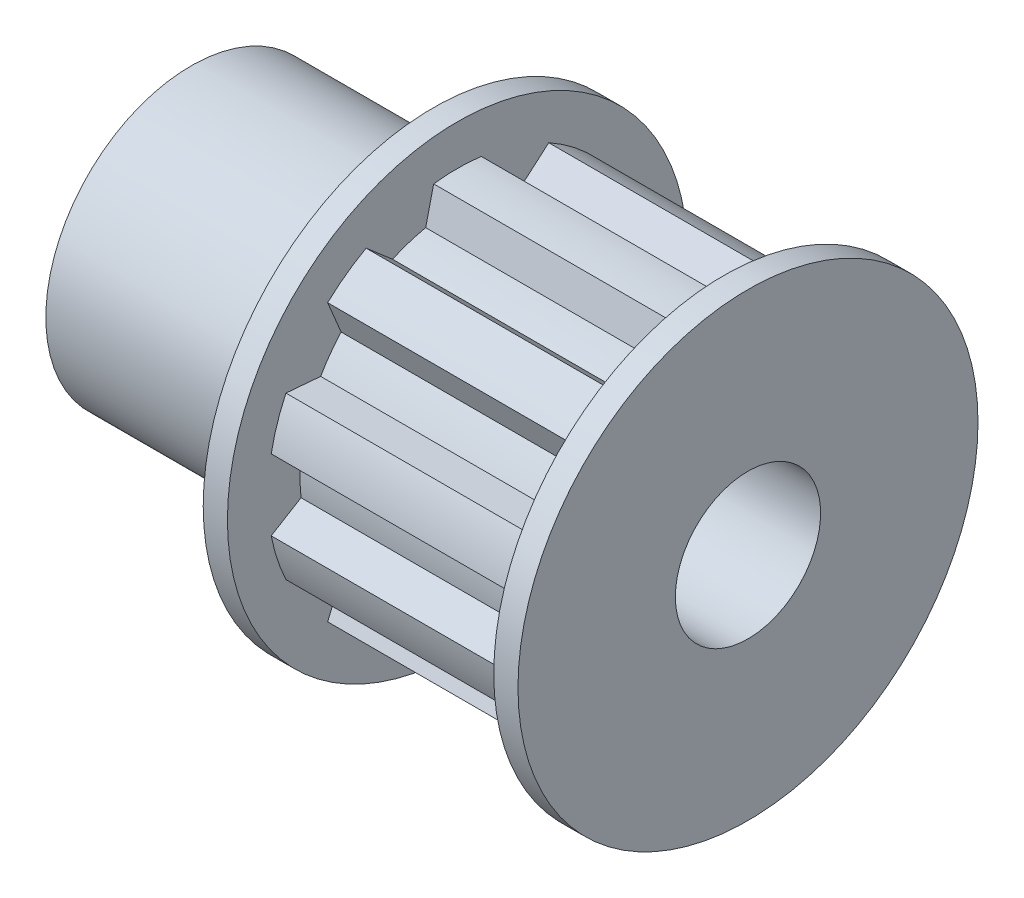
from build123d import *

# Parameters (mm, degrees)
SKETCH1_R           = 6
BOSS_EXTRUDE1_DEPTH = 10
SKETCH2_R           = 9.5
BOSS_EXTRUDE2_DEPTH = 1
BOSS_EXTRUDE3_DEPTH = 11
SKETCH4_R           = 9.5
BOSS_EXTRUDE4_DEPTH = 1
SKETCH5_R           = 3
CUT_EXTRUDE1_DEPTH  = 27.636441204
SKETCH6_R           = 2
CUT_EXTRUDE2_DEPTH  = 27.636441204


with BuildPart() as part:
    # Sketch1 → Boss-Extrude1 (new body)
    with BuildSketch(Plane(origin=(0, 0, 0), x_dir=(0, 0, -1), z_dir=(1, 0, 0))):
        Circle(SKETCH1_R)
    extrude(amount=BOSS_EXTRUDE1_DEPTH)

    # Sketch2 → Boss-Extrude2 (add)
    with BuildSketch(Plane(origin=(10, 0, 0), x_dir=(0, 0, -1), z_dir=(1, 0, 0))):
        Circle(SKETCH2_R)
    extrude(amount=BOSS_EXTRUDE2_DEPTH)

    # Sketch3 → Boss-Extrude3 (add)
    with BuildSketch(Plane(origin=(11, 0, 0), x_dir=(0, 0, -1), z_dir=(1, 0, 0))):
        with BuildLine():
            Line((-0.982460567, 7.768118899), (-1.311725835, 6.366268557))
            ThreePointArc((-1.311725835, 6.366268557), (-2.008610463, 6.181867356), (-2.680790278, 5.921432554))
            Line((-2.680790278, 5.921432554), (-3.771158432, 6.862016036))
            ThreePointArc((-3.771158432, 6.862016036), (-4.602358525, 6.334603066), (-5.360813022, 5.707064372))
            Line((-5.360813022, 5.707064372), (-4.803207262, 4.379406352))
            ThreePointArc((-4.803207262, 4.379406352), (-5.258610463, 3.82060414), (-5.64933562, 3.214810577))
            Line((-5.64933562, 3.214810577), (-7.084323087, 3.334856278))
            ThreePointArc((-7.084323087, 3.334856278), (-7.446772523, 2.419603066), (-7.69151711, 1.46610523))
            Line((-7.69151711, 1.46610523), (-6.46002677, 0.719759772))
            ThreePointArc((-6.46002677, 0.719759772), (-6.5, 0), (-6.46002677, -0.719759772))
            Line((-6.46002677, -0.719759772), (-7.69151711, -1.46610523))
            ThreePointArc((-7.69151711, -1.46610523), (-7.446772523, -2.419603066), (-7.084323087, -3.334856278))
            Line((-7.084323087, -3.334856278), (-5.64933562, -3.214810577))
            ThreePointArc((-5.64933562, -3.214810577), (-5.258610463, -3.82060414), (-4.803207262, -4.379406352))
            Line((-4.803207262, -4.379406352), (-5.360813022, -5.707064372))
            ThreePointArc((-5.360813022, -5.707064372), (-4.602358525, -6.334603066), (-3.771158432, -6.862016036))
            Line((-3.771158432, -6.862016036), (-2.680790278, -5.921432554))
            ThreePointArc((-2.680790278, -5.921432554), (-2.008610463, -6.181867356), (-1.311725835, -6.366268557))
            Line((-1.311725835, -6.366268557), (-0.982460567, -7.768118899))
            ThreePointArc((-0.982460567, -7.768118899), (0, -7.83), (0.982460567, -7.768118899))
            Line((0.982460567, -7.768118899), (1.311725835, -6.366268557))
            ThreePointArc((1.311725835, -6.366268557), (2.008610463, -6.181867356), (2.680790278, -5.921432554))
            Line((2.680790278, -5.921432554), (3.771158432, -6.862016036))
            ThreePointArc((3.771158432, -6.862016036), (4.602358525, -6.334603066), (5.360813022, -5.707064372))
            Line((5.360813022, -5.707064372), (4.803207262, -4.379406352))
            ThreePointArc((4.803207262, -4.379406352), (5.258610463, -3.82060414), (5.64933562, -3.214810577))
            Line((5.64933562, -3.214810577), (7.084323087, -3.334856278))
            ThreePointArc((7.084323087, -3.334856278), (7.446772523, -2.419603066), (7.69151711, -1.46610523))
            Line((7.69151711, -1.46610523), (6.46002677, -0.719759772))
            ThreePointArc((6.46002677, -0.719759772), (6.5, 0), (6.46002677, 0.719759772))
            Line((6.46002677, 0.719759772), (7.69151711, 1.46610523))
            ThreePointArc((7.69151711, 1.46610523), (7.446772523, 2.419603066), (7.084323087, 3.334856278))
            Line((7.084323087, 3.334856278), (5.64933562, 3.214810577))
            ThreePointArc((5.64933562, 3.214810577), (5.258610463, 3.82060414), (4.803207262, 4.379406352))
            Line((4.803207262, 4.379406352), (5.360813022, 5.707064372))
            ThreePointArc((5.360813022, 5.707064372), (4.602358525, 6.334603066), (3.771158432, 6.862016036))
            Line((3.771158432, 6.862016036), (2.680790278, 5.921432554))
            ThreePointArc((2.680790278, 5.921432554), (2.008610463, 6.181867356), (1.311725835, 6.366268557))
            Line((1.311725835, 6.366268557), (0.982460567, 7.768118899))
            ThreePointArc((0.982460567, 7.768118899), (0, 7.83), (-0.982460567, 7.768118899))
        make_face()
    extrude(amount=BOSS_EXTRUDE3_DEPTH)

    # Sketch4 → Boss-Extrude4 (add)
    with BuildSketch(Plane(origin=(22, 0, 0), x_dir=(0, 0, -1), z_dir=(1, 0, 0))):
        Circle(SKETCH4_R)
    extrude(amount=BOSS_EXTRUDE4_DEPTH)

    # Sketch5 → Cut-Extrude1 (cut, through all)
    with BuildSketch(Plane.ZY):
        Circle(SKETCH5_R)
    extrude(amount=-CUT_EXTRUDE1_DEPTH, mode=Mode.SUBTRACT)

    # Sketch6 → Cut-Extrude2 (cut, through all)
    with BuildSketch(Plane(origin=(0, 0, 0), x_dir=(1, 0, 0), z_dir=(0, 1, 0))):
        with Locations(Location((5, 0, 0), (0, 0, 270))):
            Circle(SKETCH6_R)
    extrude(amount=-CUT_EXTRUDE2_DEPTH, mode=Mode.SUBTRACT)


solid = part.part
